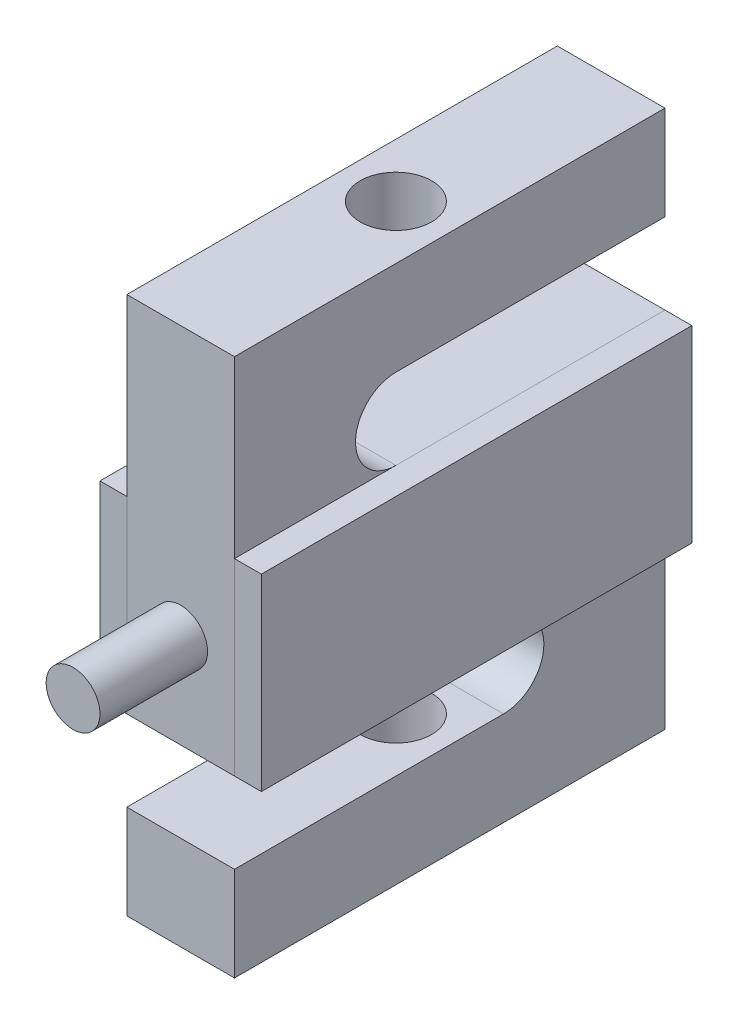
from build123d import *

# Parameters (mm, degrees)
EXTRUDE1_DEPTH = 6.35
SKETCH2_W      = 50.8
SKETCH2_H      = 22.225
EXTRUDE2_DEPTH = 3.175
SKETCH3_W      = 50.8
SKETCH3_H      = 22.225
EXTRUDE3_DEPTH = 3.175
SKETCH4_W      = 4.2164
SKETCH4_H      = 11.1125
SKETCH8_W      = 4.2164
SKETCH8_H      = 11.1125
SKETCH10_R     = 3.175
EXTRUDE4_DEPTH = 12.7


with BuildPart() as part:
    # Sketch1 → Extrude1 (new, symmetric)
    with BuildSketch(Plane(origin=(0, 0, 0), x_dir=(0, 0, -1), z_dir=(1, 0, 0))):
        with BuildLine():
            Line((50.8, 52.3875), (19.05, 52.3875))
            ThreePointArc((19.05, 52.3875), (14.2875, 47.625), (19.05, 42.8625))
            Line((19.05, 42.8625), (50.8, 42.8625))
            Line((50.8, 42.8625), (50.8, 0))
            Line((50.8, 0), (0, 0))
            Line((0, 0), (0, 11.1125))
            Line((0, 11.1125), (31.75, 11.1125))
            ThreePointArc((31.75, 11.1125), (36.5125, 15.875), (31.75, 20.6375))
            Line((31.75, 20.6375), (0, 20.6375))
            Line((0, 20.6375), (0, 63.5))
            Line((0, 63.5), (50.8, 63.5))
            Line((50.8, 63.5), (50.8, 52.3875))
        make_face()
    extrude(amount=EXTRUDE1_DEPTH, both=True)

    # Sketch4 → 3/8-24 Tapped Hole1 (revolve, cut)
    with BuildSketch(Plane(origin=(0, 63.5, -25.4), x_dir=(0, 0, 1), z_dir=(1, 0, 0))):
        with Locations((2.1082, 5.55625)):
            Rectangle(SKETCH4_W, SKETCH4_H)
    revolve(axis=Axis((0, 69.85, -25.4), (0, -1, 0)), mode=Mode.SUBTRACT)

    # Sketch8 → 3/8-24 Tapped Hole2 (revolve, cut)
    with BuildSketch(Plane(origin=(0, 0, -25.4), x_dir=(0, 0, -1), z_dir=(1, 0, 0))):
        with Locations((2.1082, 5.55625)):
            Rectangle(SKETCH8_W, SKETCH8_H)
    revolve(axis=Axis((0, -6.35, -25.4), (0, 1, 0)), mode=Mode.SUBTRACT)

    # Sketch10 → Extrude4 (add)
    with BuildSketch(Plane.XY):
        with Locations(Location((0, 31.75, 0), (0, 0, 180))):
            Circle(SKETCH10_R)
    extrude(amount=EXTRUDE4_DEPTH)


with BuildPart() as body_2:
    # Sketch2 → Extrude2 (new body)
    with BuildSketch(Plane(origin=(6.35, 0, 0), x_dir=(0, 0, -1), z_dir=(1, 0, 0))):
        with Locations((25.4, 31.75)):
            Rectangle(SKETCH2_W, SKETCH2_H)
    extrude(amount=EXTRUDE2_DEPTH)


with BuildPart() as body_3:
    # Sketch3 → Extrude3 (new body)
    with BuildSketch(Plane.ZY.offset(6.35)):
        with Locations((-25.4, 31.75)):
            Rectangle(SKETCH3_W, SKETCH3_H)
    extrude(amount=EXTRUDE3_DEPTH)


solid = Compound([part.part, body_2.part, body_3.part])
